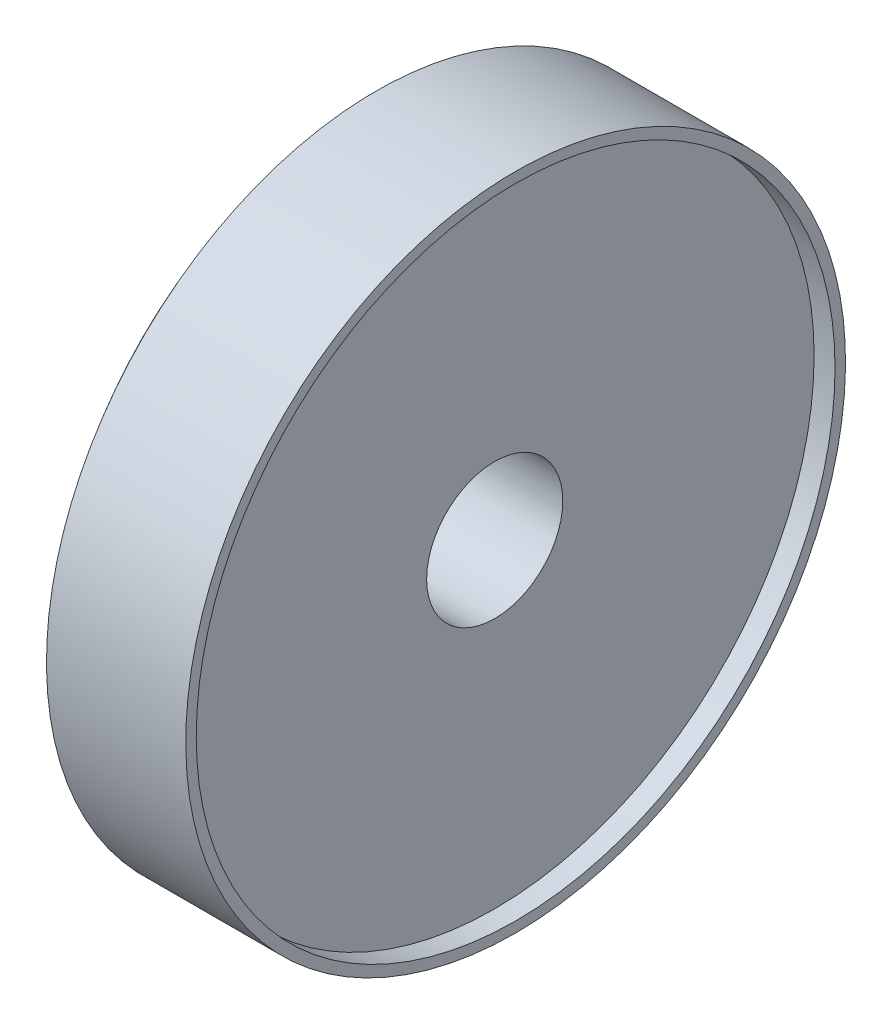
from build123d import *

# Parameters (mm, degrees)
SKETCH2_R                       = 30.5
CUT_EXTRUDE1_DEPTH              = 2
M3X0_5_TAPPED_HOLE1_D           = 2.5
M3X0_5_TAPPED_HOLE1_DEPTH       = 7.5
M3X0_5_TAPPED_HOLE1_TIP         = 0.751075774
M3X0_5_TAPPED_HOLE2_D           = 2.5
M3X0_5_TAPPED_HOLE2_DEPTH       = 7.5
M3X0_5_TAPPED_HOLE2_CSINK_D     = 3.05
M3X0_5_TAPPED_HOLE2_CSINK_ANGLE = 90
M3X0_5_TAPPED_HOLE2_TIP         = 0.751075774
M3X0_5_TAPPED_HOLE3_D           = 2.5
M3X0_5_TAPPED_HOLE3_DEPTH       = 7.5
M3X0_5_TAPPED_HOLE3_CSINK_D     = 3.05
M3X0_5_TAPPED_HOLE3_CSINK_ANGLE = 90
M3X0_5_TAPPED_HOLE3_TIP         = 0.751075774
SKETCH11_R                      = 6.5
CUT_EXTRUDE2_DEPTH              = 13.8


with BuildPart() as part:
    # Sketch1 → Revolve1 (revolve)
    with BuildSketch(Plane.XY, mode=Mode.PRIVATE) as revolve1_sk:
        Polygon((-7.9, 0), (7.9, 0), (7.9, 31.5), (-5.4, 31.5), (-7.9, 28), align=None)
    revolve(revolve1_sk.sketch.rotate(Axis((-7.9, 0, 0), (1, 0, 0)), 180), axis=Axis((-7.9, 0, 0), (1, 0, 0)))

    # Sketch2 → Cut-Extrude1 (cut)
    with BuildSketch(Plane(origin=(7.9, 0, 0), x_dir=(0, 0, -1), z_dir=(1, 0, 0))):
        with Locations(Location((0, 0, 0), (0, 0, 90))):
            Circle(SKETCH2_R)
    extrude(amount=-CUT_EXTRUDE1_DEPTH, mode=Mode.SUBTRACT)

    # M3x0.5 Tapped Hole1
    with Locations(Plane.ZY.offset(7.9)):
        with Locations((-15.556349186, 15.556349186), (15.556349186, 15.556349186), (15.556349186, -15.556349186), (-15.556349186, -15.556349186)):
            Hole(M3X0_5_TAPPED_HOLE1_D / 2, depth=M3X0_5_TAPPED_HOLE1_DEPTH)
            with Locations((0, 0, -(M3X0_5_TAPPED_HOLE1_DEPTH + M3X0_5_TAPPED_HOLE1_TIP / 2))):  # 118° drill point
                Cone(0, M3X0_5_TAPPED_HOLE1_D / 2, M3X0_5_TAPPED_HOLE1_TIP, mode=Mode.SUBTRACT)

    # M3x0.5 Tapped Hole2
    with Locations(Plane.ZY.offset(7.9)):
        with Locations((-10.606601718, 10.606601718), (-10.606601718, -10.606601718), (10.606601718, -10.606601718), (10.606601718, 10.606601718)):
            CounterSinkHole(M3X0_5_TAPPED_HOLE2_D / 2, M3X0_5_TAPPED_HOLE2_CSINK_D / 2, depth=M3X0_5_TAPPED_HOLE2_DEPTH, counter_sink_angle=M3X0_5_TAPPED_HOLE2_CSINK_ANGLE)
            with Locations((0, 0, -(M3X0_5_TAPPED_HOLE2_DEPTH + M3X0_5_TAPPED_HOLE2_TIP / 2))):  # 118° drill point
                Cone(0, M3X0_5_TAPPED_HOLE2_D / 2, M3X0_5_TAPPED_HOLE2_TIP, mode=Mode.SUBTRACT)

    # M3x0.5 Tapped Hole3
    with Locations(Plane.ZY.offset(7.9)):
        with Locations((0, 12.5), (-12.5, 0), (0, -12.5), (12.5, 0)):
            CounterSinkHole(M3X0_5_TAPPED_HOLE3_D / 2, M3X0_5_TAPPED_HOLE3_CSINK_D / 2, depth=M3X0_5_TAPPED_HOLE3_DEPTH, counter_sink_angle=M3X0_5_TAPPED_HOLE3_CSINK_ANGLE)
            with Locations((0, 0, -(M3X0_5_TAPPED_HOLE3_DEPTH + M3X0_5_TAPPED_HOLE3_TIP / 2))):  # 118° drill point
                Cone(0, M3X0_5_TAPPED_HOLE3_D / 2, M3X0_5_TAPPED_HOLE3_TIP, mode=Mode.SUBTRACT)

    # Sketch11 → Cut-Extrude2 (cut)
    with BuildSketch(Plane.ZY.offset(7.9)):
        with Locations(Location((0, 0, 0), (0, 0, 270))):
            Circle(SKETCH11_R)
    extrude(amount=-CUT_EXTRUDE2_DEPTH, mode=Mode.SUBTRACT)


solid = part.part
